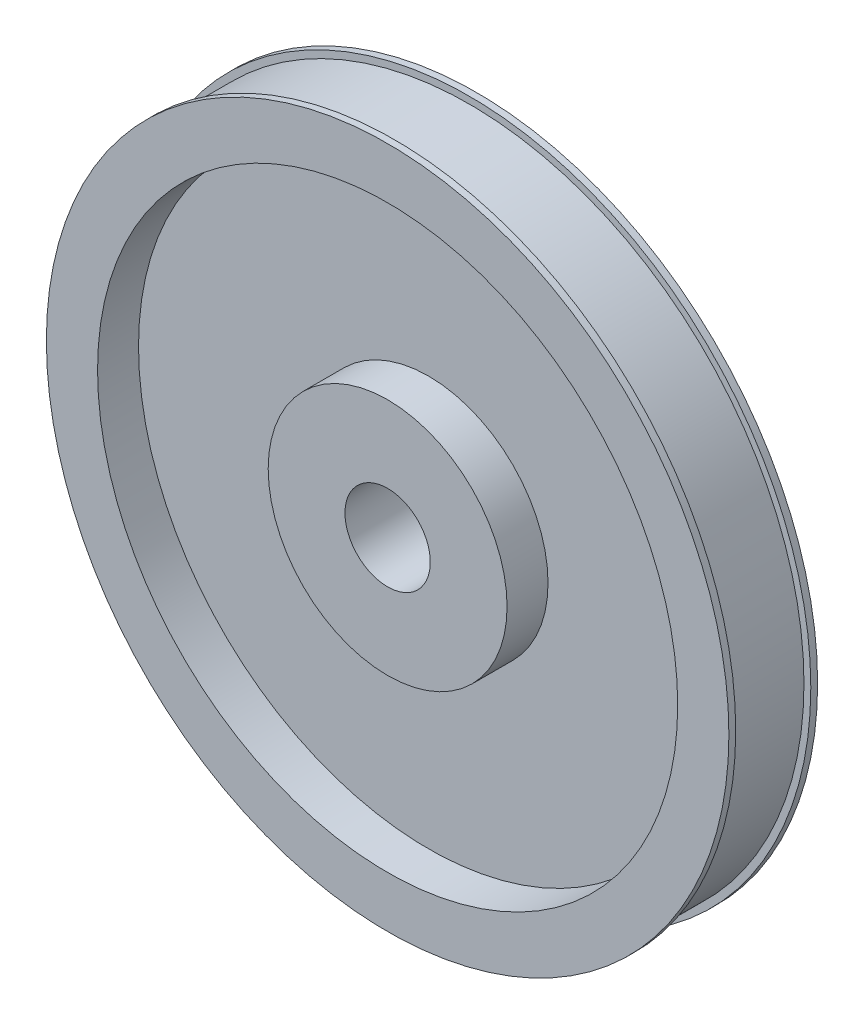
from build123d import *

# Parameters (mm, degrees)
SKETCH1_R           = 100
SKETCH1_R_2         = 12.5
BOSS_EXTRUDE1_DEPTH = 26
SKETCH3_OUTSIDE_W   = 258.808
SKETCH3_OUTSIDE_H   = 258.808
SKETCH3_OUTSIDE_R   = 98
CUT_EXTRUDE3_DEPTH  = 24
BOSS_EXTRUDE3_START = -2
SKETCH6_R           = 100
BOSS_EXTRUDE3_DEPTH = 2
SKETCH7_R           = 12.5
CUT_EXTRUDE6_DEPTH  = 144.791515744
SKETCH8_R           = 85
SKETCH8_R_2         = 35
CUT_EXTRUDE7_DEPTH  = 12


with BuildPart() as part:
    # Sketch1 → Boss-Extrude1 (new body)
    with BuildSketch(Plane.XY):
        with Locations(Location((0, 0, 0), (0, 0, 180))):
            Circle(SKETCH1_R)
        with Locations(Location((0, 0, 0), (0, 0, 180))):
            Circle(SKETCH1_R_2, mode=Mode.SUBTRACT)
    extrude(amount=BOSS_EXTRUDE1_DEPTH)

    # Sketch3 outside → Cut-Extrude3 (cut)
    with BuildSketch(Plane.XY.offset(26)):
        Rectangle(SKETCH3_OUTSIDE_W, SKETCH3_OUTSIDE_H)
        Circle(SKETCH3_OUTSIDE_R, mode=Mode.SUBTRACT)
    extrude(amount=-CUT_EXTRUDE3_DEPTH, mode=Mode.SUBTRACT)

    # Sketch6 → Boss-Extrude3 (add)
    with BuildSketch(Plane.XY.offset(26).offset(BOSS_EXTRUDE3_START)):
        with Locations(Location((0, 0, 0), (0, 0, 180))):
            Circle(SKETCH6_R)
    extrude(amount=BOSS_EXTRUDE3_DEPTH)

    # Sketch7 → Cut-Extrude6 (cut, through all)
    with BuildSketch(Plane(origin=(0, 0, 0), x_dir=(-1, 0, 0), z_dir=(0, 0, -1))):
        Circle(SKETCH7_R)
    extrude(amount=-CUT_EXTRUDE6_DEPTH, mode=Mode.SUBTRACT)

    # Sketch8 → Cut-Extrude7 (cut)
    with BuildSketch(Plane.XY.offset(26)):
        Circle(SKETCH8_R)
        Circle(SKETCH8_R_2, mode=Mode.SUBTRACT)
    extrude(amount=-CUT_EXTRUDE7_DEPTH, mode=Mode.SUBTRACT)


solid = part.part
